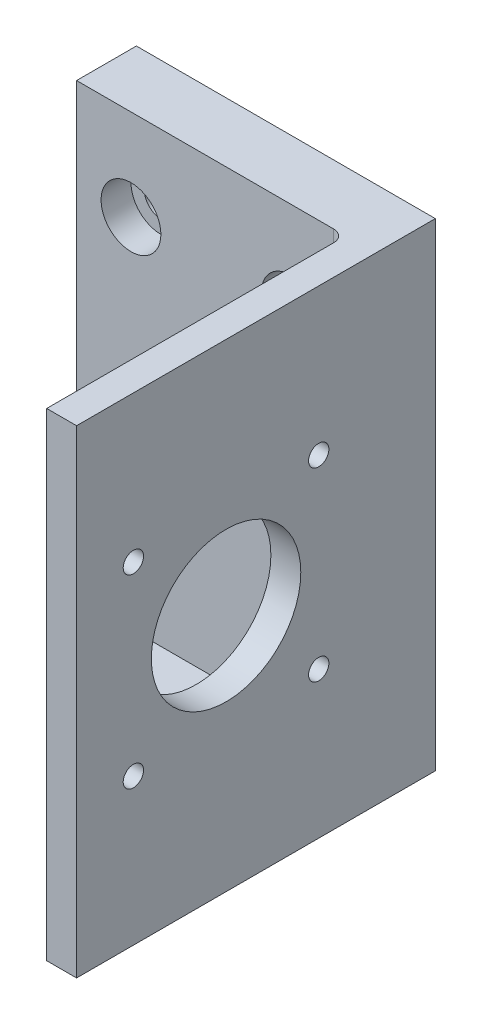
from build123d import *

# Parameters (mm, degrees)
SKETCH1_W                      = 50
SKETCH1_H                      = 80
BOSS_EXTRUDE1_DEPTH            = 10
SKETCH2_W                      = 5
SKETCH2_H                      = 80
BOSS_EXTRUDE2_DEPTH            = 50
SKETCH3_R                      = 12.5
CUT_EXTRUDE1_DEPTH             = 88.749643874
M3_CLEARANCE_HOLE1_D           = 3.4
CBORE_FOR_M5_SHCS1_D           = 5.5
CBORE_FOR_M5_SHCS1_CBORE_D     = 10
CBORE_FOR_M5_SHCS1_CBORE_DEPTH = 5
FILLET11_R                     = 2
BOSS_EXTRUDE3_DEPTH            = 5.08


with BuildPart() as part:
    # Sketch1 → Boss-Extrude1 (new body)
    with BuildSketch(Plane.XY):
        Rectangle(SKETCH1_W, SKETCH1_H)
    extrude(amount=BOSS_EXTRUDE1_DEPTH)

    # Sketch2 → Boss-Extrude2 (add)
    with BuildSketch(Plane.XY.offset(10)):
        with Locations((22.5, 0)):
            Rectangle(SKETCH2_W, SKETCH2_H)
    extrude(amount=BOSS_EXTRUDE2_DEPTH)

    # Sketch3 → Cut-Extrude1 (cut, through all)
    with BuildSketch(Plane(origin=(25, 0, 0), x_dir=(0, 0, -1), z_dir=(1, 0, 0))):
        with Locations((-35, 0)):
            Circle(SKETCH3_R)
    extrude(amount=-CUT_EXTRUDE1_DEPTH, mode=Mode.SUBTRACT)

    # M3 Clearance Hole1 (through all)
    with Locations(Plane(origin=(25, 0, 0), x_dir=(0, 0, -1), z_dir=(1, 0, 0))):
        with Locations((-50.5, -15.5), (-35, 0), (-50.5, 15.5), (-19.5, -15.5), (-19.5, 15.5)):
            Hole(M3_CLEARANCE_HOLE1_D / 2)

    # CBORE for M5 SHCS1 (through all)
    with Locations(Plane.XY.offset(10)):
        with Locations((-15.902931391, 24.76), (10.902931391, 24.76), (-15.902931391, -24.76), (10.902931391, -24.76)):
            CounterBoreHole(CBORE_FOR_M5_SHCS1_D / 2, CBORE_FOR_M5_SHCS1_CBORE_D / 2, CBORE_FOR_M5_SHCS1_CBORE_DEPTH)

    # Fillet11
    fillet11_edges = [part.edges().sort_by_distance(p)[0] for p in [
        (20, 0, 10),
    ]]
    fillet(fillet11_edges, radius=FILLET11_R)

    # Sketch8 → Boss-Extrude3 (add)
    with BuildSketch(Plane.XZ.offset(40)):
        Polygon((20, 60), (-25, 10), (20, 10), align=None)
    extrude(amount=-BOSS_EXTRUDE3_DEPTH)


solid = part.part
